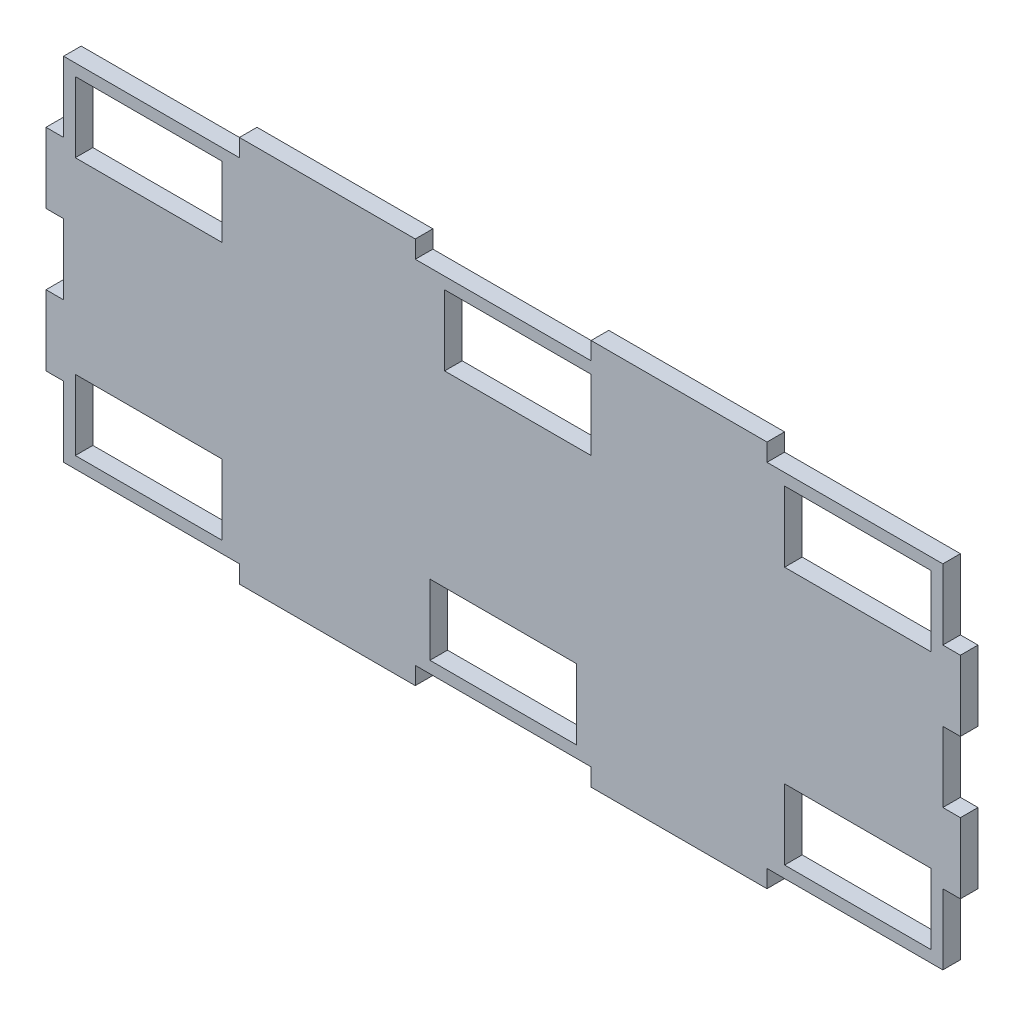
from build123d import *

# Parameters (mm, degrees)
ESBO_O1_W                = 25
ESBO_O1_H                = 12
RESSALTO_EXTRUS_O1_DEPTH = 3


with BuildPart() as part:
    # Esboço1 → Ressalto-extrusão1 (new body)
    with BuildSketch(Plane.XY):
        Polygon((-15, 30), (15, 30), (15, 33), (45, 33), (45, 30), (75, 30), (75, 18), (78, 18), (78, 6), (75, 6), (75, -6), (78, -6), (78, -18), (75, -18), (75, -30), (45, -30), (45, -33), (15, -33), (15, -30), (-15, -30), (-15, -33), (-45, -33), (-45, -30), (-75, -30), (-75, -18), (-78, -18), (-78, -6), (-75, -6), (-75, 6), (-78, 6), (-78, 18), (-75, 18), (-75, 30), (-45, 30), (-45, 33), (-15, 33), align=None)
        with Locations((60.5, -22)):
            Rectangle(ESBO_O1_W, ESBO_O1_H, mode=Mode.SUBTRACT)
        with Locations((-60.5, -22)):
            Rectangle(ESBO_O1_W, ESBO_O1_H, mode=Mode.SUBTRACT)
        with Locations((-60.5, 22)):
            Rectangle(ESBO_O1_W, ESBO_O1_H, mode=Mode.SUBTRACT)
        with Locations((60.5, 22)):
            Rectangle(ESBO_O1_W, ESBO_O1_H, mode=Mode.SUBTRACT)
        with Locations((0, -22)):
            Rectangle(ESBO_O1_W, ESBO_O1_H, mode=Mode.SUBTRACT)
        with Locations((2.5, 22)):
            Rectangle(ESBO_O1_W, ESBO_O1_H, mode=Mode.SUBTRACT)
    extrude(amount=RESSALTO_EXTRUS_O1_DEPTH)


solid = part.part
